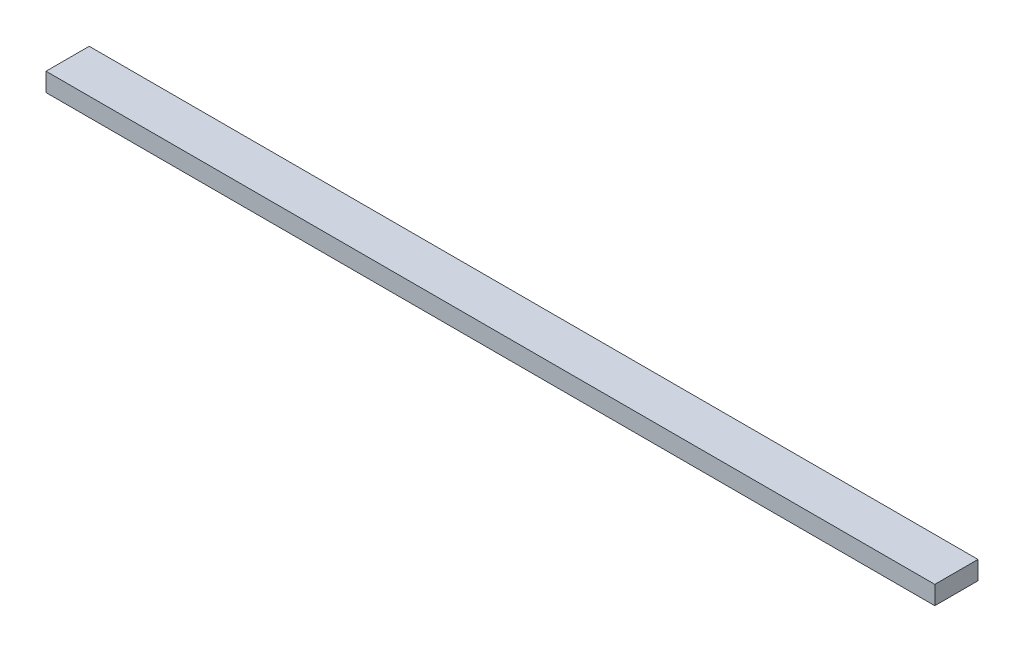
from build123d import *

# Parameters (mm, degrees)
SKETCH1_W           = 1828.8
SKETCH1_H           = 88.9
BOSS_EXTRUDE1_DEPTH = 38.1


with BuildPart() as part:
    # Sketch1 → Boss-Extrude1 (new body)
    with BuildSketch(Plane(origin=(0, 0, 0), x_dir=(1, 0, 0), z_dir=(0, 1, 0))):
        with Locations((914.4, 44.45)):
            Rectangle(SKETCH1_W, SKETCH1_H)
    extrude(amount=-BOSS_EXTRUDE1_DEPTH)


solid = part.part
